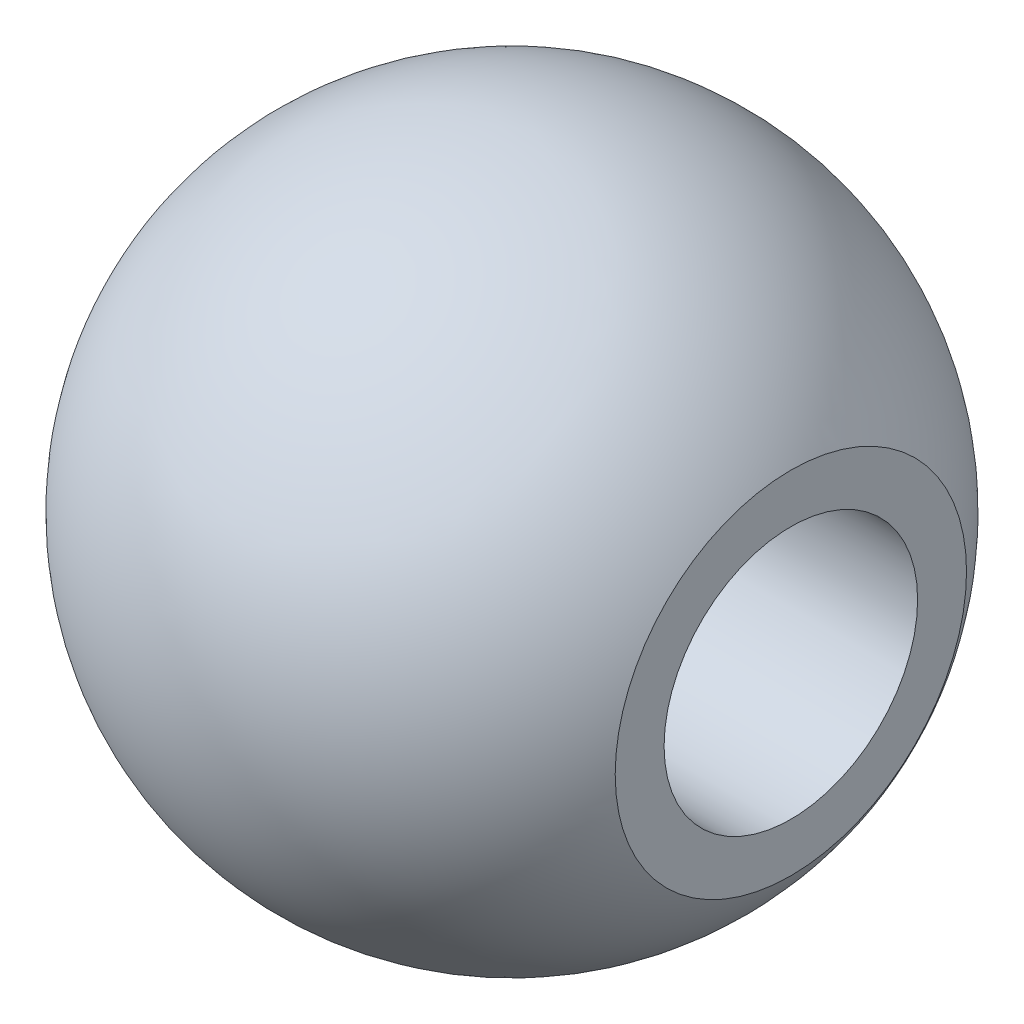
from build123d import *

# Parameters (mm, degrees)
CUT_EXTRUDE3_DEPTH      = 5.5033321
CUT_EXTRUDE3_DEPTH_BACK = 5.5033321
SKETCH5_W               = 0.4
SKETCH5_H               = 8.681299001
SKETCH6_R               = 1
CUT_EXTRUDE5_DEPTH      = 6.734108475


with BuildPart() as part:
    # Sketch1 one side → Revolve5 (revolve)
    with BuildSketch(Plane.XY):
        with BuildLine():
            ThreePointArc((0, -2.6), (1.838477631, -1.838477631), (2.6, 0))
            ThreePointArc((2.6, 0), (1.838477631, 1.838477631), (0, 2.6))
            Line((0, 2.6), (0, -2.6))
        make_face()
    revolve(axis=Axis((0, 2.6, 0), (0, -1, 0)))

    # Sketch5 → Cut-Extrude3 (cut, two sides: drawn at the far end of the back side and taken through both)
    with BuildSketch(Plane.XY.offset(-CUT_EXTRUDE3_DEPTH_BACK)):
        with Locations((-2.4, -0.428203102)):
            Rectangle(SKETCH5_W, SKETCH5_H)
        with Locations((2.4, -0.428203102)):
            Rectangle(SKETCH5_W, SKETCH5_H)
    extrude(amount=CUT_EXTRUDE3_DEPTH + CUT_EXTRUDE3_DEPTH_BACK, mode=Mode.SUBTRACT)

    # Sketch6 → Cut-Extrude5 (cut, through all)
    with BuildSketch(Plane(origin=(2.2, 0, 0), x_dir=(0, 0, -1), z_dir=(1, 0, 0))):
        Circle(SKETCH6_R)
    extrude(amount=-CUT_EXTRUDE5_DEPTH, mode=Mode.SUBTRACT)


solid = part.part
